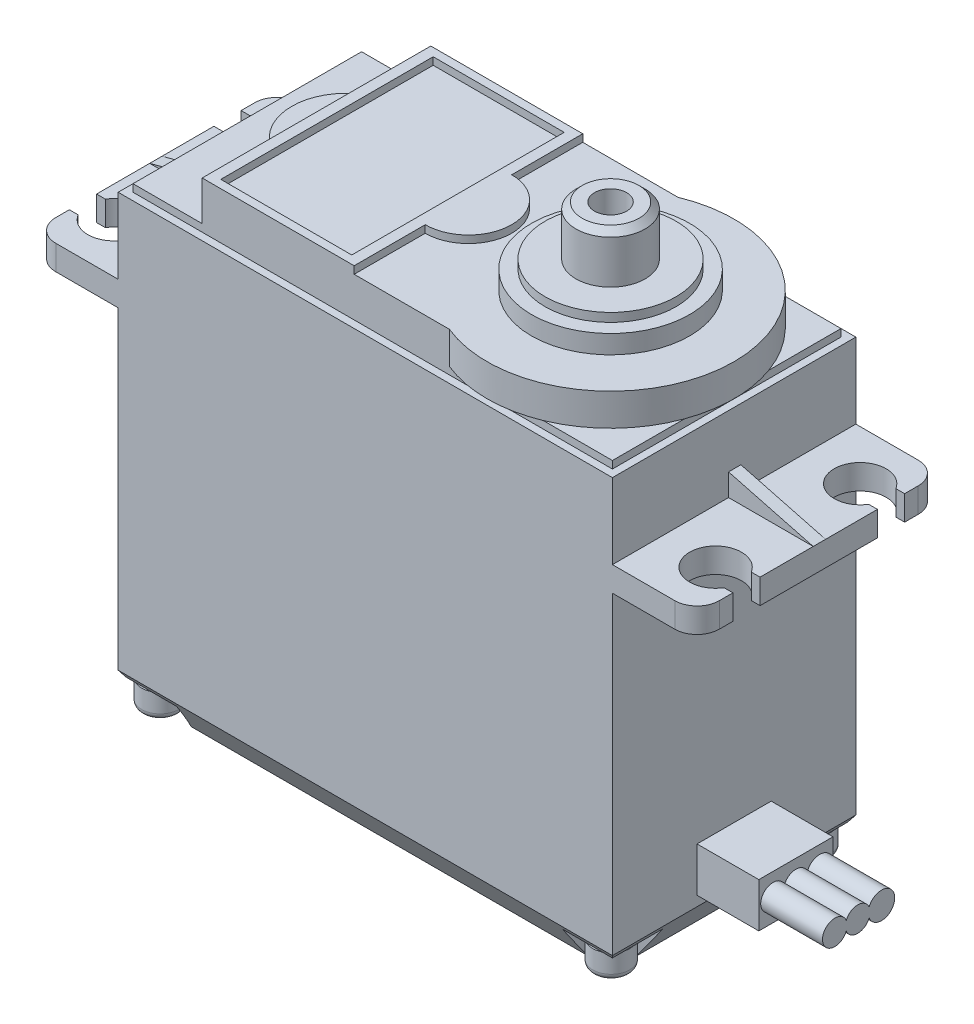
from build123d import *

# Parameters (mm, degrees)
SKETCH1_W            = 40
SKETCH1_H            = 36.5
BOSS_EXTRUDE1_DEPTH  = 19.7
CHAMFER1_SIZE        = 2
CHAMFER1_SIZE2       = 3
CUT_EXTRUDE1_DEPTH   = 2.5
SKETCH4_R            = 1.5
BOSS_EXTRUDE2_DEPTH  = 2
FILLET1_R            = 0.5
FILLET3_R            = 0.5
FILLET4_R            = 0.5
FILLET5_R            = 0.5
SKETCH5_W            = 53.7
SKETCH5_H            = 19.7
BOSS_EXTRUDE3_DEPTH  = 2
CUT_EXTRUDE2_DEPTH   = 2
FILLET9_R            = 1.8
BOSS_EXTRUDE4_DEPTH  = 1
SKETCH8_W            = 38.8
SKETCH8_H            = 18.5
BOSS_EXTRUDE5_DEPTH  = 0.6
BOSS_EXTRUDE6_DEPTH  = 2.6
SKETCH10_W           = 10.6
SKETCH10_H           = 17.190691902
BOSS_EXTRUDE7_DEPTH  = 0.6
SKETCH11_R           = 6.4
BOSS_EXTRUDE8_DEPTH  = 1.5
SKETCH12_R           = 5.3
BOSS_EXTRUDE9_DEPTH  = 0.7
SKETCH13_R           = 2.8
SKETCH13_R_2         = 1.3
BOSS_EXTRUDE10_DEPTH = 4
CHAMFER2_SIZE        = 0.5
CUT_EXTRUDE3_DEPTH   = 1.2
LPATTERN1_COUNT      = 2
LPATTERN1_PITCH      = 36.5
LPATTERN1_COUNT_DIR2 = 2
LPATTERN1_PITCH_DIR2 = 16.3
SKETCH16_W           = 6
SKETCH16_H           = 3.6
BOSS_EXTRUDE11_DEPTH = 5
BOSS_EXTRUDE16_DEPTH = 5
BOSS_EXTRUDE42_DEPTH = 5


with BuildPart() as part:
    # Sketch1 → Boss-Extrude1 (new body)
    with BuildSketch(Plane.XY):
        Rectangle(SKETCH1_W, SKETCH1_H)
    extrude(amount=BOSS_EXTRUDE1_DEPTH)

    # Chamfer1
    chamfer1_edges = [part.edges().sort_by_distance(p)[0] for p in [
        (0, -18.25, 19.7),
        (0, -18.25, 0),
        (20, -18.25, 9.85),
        (-20, -18.25, 9.85),
    ]]
    chamfer1_side = [part.faces().sort_by_distance(p)[0] for p in [
        (0, -18.25, 9.85),
    ]]
    chamfer(chamfer1_edges, length=CHAMFER1_SIZE, length2=CHAMFER1_SIZE2, reference=chamfer1_side[0])

    # Sketch2 → Cut-Extrude1 (cut)
    with BuildSketch(Plane.XZ.offset(18.25)):
        with BuildLine():
            Line((20, 15.3), (20, 19.7))
            Line((20, 19.7), (15.6, 19.7))
            ThreePointArc((15.6, 19.7), (16.888730163, 16.588730163), (20, 15.3))
        make_face()
        with BuildLine():
            Line((20, 4.4), (20, 0))
            Line((20, 0), (15.6, 0))
            ThreePointArc((15.6, 0), (16.888730163, 3.111269837), (20, 4.4))
        make_face()
        with BuildLine():
            Line((-15.6, 0), (-20, 0))
            Line((-20, 0), (-20, 4.4))
            ThreePointArc((-20, 4.4), (-16.888730163, 3.111269837), (-15.6, 0))
        make_face()
        with BuildLine():
            Line((-20, 15.3), (-20, 19.7))
            Line((-20, 19.7), (-15.6, 19.7))
            ThreePointArc((-15.6, 19.7), (-16.888730163, 16.588730163), (-20, 15.3))
        make_face()
    extrude(amount=-CUT_EXTRUDE1_DEPTH, mode=Mode.SUBTRACT)

    # Sketch4 → Boss-Extrude2 (add)
    with BuildSketch(Plane.XZ.offset(15.75)):
        with Locations(Location((18.20504142, 18.001219169, 0), (0, 0, 114.453388665))):
            Circle(SKETCH4_R)
        with Locations(Location((18.20504142, 1.751219169, 0), (0, 0, 250.954058998))):
            Circle(SKETCH4_R)
        with Locations(Location((-18.29495858, 1.751219169, 0), (0, 0, 203.869136849))):
            Circle(SKETCH4_R)
        with Locations(Location((-18.29495858, 18.001219169, 0), (0, 0, 156.130863151))):
            Circle(SKETCH4_R)
    extrude(amount=BOSS_EXTRUDE2_DEPTH)

    # Fillet1
    fillet1_edges = [part.edges().sort_by_distance(p)[0] for p in [
        (-16.923250494, -17.75, 17.39424559),
    ]]
    fillet(fillet1_edges, radius=FILLET1_R)

    # Fillet3
    fillet3_edges = [part.edges().sort_by_distance(p)[0] for p in [
        (-16.923250494, -17.75, 2.358192748),
    ]]
    fillet(fillet3_edges, radius=FILLET3_R)

    # Fillet4
    fillet4_edges = [part.edges().sort_by_distance(p)[0] for p in [
        (18.6945307, -17.75, 3.169105006),
    ]]
    fillet(fillet4_edges, radius=FILLET4_R)

    # Fillet5
    fillet5_edges = [part.edges().sort_by_distance(p)[0] for p in [
        (18.825970669, -17.75, 16.635771672),
    ]]
    fillet(fillet5_edges, radius=FILLET5_R)

    # Sketch5 → Boss-Extrude3 (add)
    with BuildSketch(Plane(origin=(0, 10.15, 0), x_dir=(-1, 0, 0), z_dir=(0, -1, 0))):
        with Locations((0, -9.85)):
            Rectangle(SKETCH5_W, SKETCH5_H)
    extrude(amount=-BOSS_EXTRUDE3_DEPTH)

    # Sketch6 → Cut-Extrude2 (cut)
    with BuildSketch(Plane.XZ.offset(-10.15)):
        with BuildLine():
            Line((26.85, 14.6), (26.138854382, 14.6))
            ThreePointArc((26.138854382, 14.6), (22.25, 15.7), (26.138854382, 16.8))
            Line((26.138854382, 16.8), (26.85, 16.8))
            Line((26.85, 16.8), (26.85, 14.6))
        make_face()
        with BuildLine():
            Line((26.85, 2.9), (26.138854382, 2.9))
            ThreePointArc((26.138854382, 2.9), (22.25, 4), (26.138854382, 5.1))
            Line((26.138854382, 5.1), (26.85, 5.1))
            Line((26.85, 5.1), (26.85, 2.9))
        make_face()
        with BuildLine():
            Line((-26.85, 5.1), (-26.138854382, 5.1))
            ThreePointArc((-26.138854382, 5.1), (-22.25, 4), (-26.138854382, 2.9))
            Line((-26.138854382, 2.9), (-26.85, 2.9))
            Line((-26.85, 2.9), (-26.85, 5.1))
        make_face()
        with BuildLine():
            Line((-26.85, 16.8), (-26.138854382, 16.8))
            ThreePointArc((-26.138854382, 16.8), (-22.25, 15.7), (-26.138854382, 14.6))
            Line((-26.138854382, 14.6), (-26.85, 14.6))
            Line((-26.85, 14.6), (-26.85, 16.8))
        make_face()
    extrude(amount=-CUT_EXTRUDE2_DEPTH, mode=Mode.SUBTRACT)

    # Fillet9
    fillet9_edges = [part.edges().sort_by_distance(p)[0] for p in [
        (26.85, 11.15, 0),
        (-26.85, 11.15, 0),
        (-26.85, 11.15, 19.7),
        (26.85, 11.15, 19.7),
    ]]
    fillet(fillet9_edges, radius=FILLET9_R)

    # Sketch7 → Boss-Extrude4 (add)
    with BuildSketch(Plane.XY.offset(10.3)):
        Polygon((-26.85, 12.15), (-20, 13.95), (-20, 12.15), align=None)
        Polygon((20, 12.15), (20, 13.95), (26.85, 12.15), align=None)
    extrude(amount=-BOSS_EXTRUDE4_DEPTH)

    # Sketch8 → Boss-Extrude5 (add)
    with BuildSketch(Plane(origin=(0, 18.25, 0), x_dir=(1, 0, 0), z_dir=(0, 1, 0))):
        with Locations((0, -9.85)):
            Rectangle(SKETCH8_W, SKETCH8_H)
    extrude(amount=BOSS_EXTRUDE5_DEPTH)

    # Sketch9 → Boss-Extrude6 (add)
    with BuildSketch(Plane(origin=(0, 18.85, 0), x_dir=(1, 0, 0), z_dir=(0, 1, 0))):
        with BuildLine():
            Line((-13.799671038, -6.162182217), (-13.799671038, -0.6))
            Line((-13.799671038, -0.6), (6.200328962, -0.6))
            ThreePointArc((6.200328962, -0.6), (20, -9.85), (6.200328962, -19.1))
            Line((6.200328962, -19.1), (-13.799671038, -19.1))
            Line((-13.799671038, -19.1), (-13.799671038, -13.537817783))
            ThreePointArc((-13.799671038, -13.537817783), (-15.799671038, -9.85), (-13.799671038, -6.162182217))
        make_face()
    extrude(amount=BOSS_EXTRUDE6_DEPTH)

    # Sketch10 → Boss-Extrude7 (add)
    with BuildSketch(Plane(origin=(0, 21.45, 0), x_dir=(1, 0, 0), z_dir=(0, 1, 0))):
        with BuildLine():
            Line((-13.799671038, -19.1), (-13.799671038, -0.6))
            Line((-13.799671038, -0.6), (-1.499671038, -0.6))
            Line((-1.499671038, -0.6), (-1.499671038, -6.35))
            ThreePointArc((-1.499671038, -6.35), (2.000328962, -9.85), (-1.499671038, -13.35))
            Line((-1.499671038, -13.35), (-1.499671038, -19.1))
            Line((-1.499671038, -19.1), (-13.799671038, -19.1))
        make_face()
        with Locations((-7.649671038, -9.85)):
            Rectangle(SKETCH10_W, SKETCH10_H, mode=Mode.SUBTRACT)
    extrude(amount=BOSS_EXTRUDE7_DEPTH)

    # Sketch11 → Boss-Extrude8 (add)
    with BuildSketch(Plane(origin=(0, 21.45, 0), x_dir=(1, 0, 0), z_dir=(0, 1, 0))):
        with Locations(Location((10, -9.85, 0), (0, 0, 270))):
            Circle(SKETCH11_R)
    extrude(amount=BOSS_EXTRUDE8_DEPTH)

    # Sketch12 → Boss-Extrude9 (add)
    with BuildSketch(Plane(origin=(0, 22.95, 0), x_dir=(1, 0, 0), z_dir=(0, 1, 0))):
        with Locations(Location((10, -9.85, 0), (0, 0, 270))):
            Circle(SKETCH12_R)
    extrude(amount=BOSS_EXTRUDE9_DEPTH)

    # Sketch13 → Boss-Extrude10 (add)
    with BuildSketch(Plane(origin=(0, 23.65, 0), x_dir=(1, 0, 0), z_dir=(0, 1, 0))):
        with Locations(Location((10, -9.85, 0), (0, 0, 270))):
            Circle(SKETCH13_R)
        with Locations(Location((10, -9.85, 0), (0, 0, 270))):
            Circle(SKETCH13_R_2, mode=Mode.SUBTRACT)
    extrude(amount=BOSS_EXTRUDE10_DEPTH)

    # Chamfer2
    chamfer2_edges = [part.edges().sort_by_distance(p)[0] for p in [
        (10, 27.65, 7.05),
    ]]
    chamfer(chamfer2_edges, length=CHAMFER2_SIZE)

    # Sketch15 → Cut-Extrude3 (cut)
    with BuildSketch(Plane.XZ.offset(17.75)):
        Polygon((18.05504142, 1.601219169), (18.05504142, 0.901219169), (18.35504142, 0.901219169), (18.35504142, 1.601219169), (19.05504142, 1.601219169), (19.05504142, 1.901219169), (18.35504142, 1.901219169), (18.35504142, 2.601219169), (18.05504142, 2.601219169), (18.05504142, 1.901219169), (17.35504142, 1.901219169), (17.35504142, 1.601219169), align=None)
    cut_extrude3 = extrude(amount=-CUT_EXTRUDE3_DEPTH, mode=Mode.SUBTRACT)

    # LPattern1: Cut-Extrude3 2 × 2
    with Locations(*[(-i * LPATTERN1_PITCH, 0, j * LPATTERN1_PITCH_DIR2) for i in range(LPATTERN1_COUNT) for j in range(LPATTERN1_COUNT_DIR2) if (i, j) != (0, 0)]):
        add(cut_extrude3, mode=Mode.SUBTRACT)

    # Sketch16 → Boss-Extrude11 (add)
    with BuildSketch(Plane(origin=(20, 0, 0), x_dir=(0, 0, -1), z_dir=(1, 0, 0))):
        with Locations((-9.85, -12.65)):
            Rectangle(SKETCH16_W, SKETCH16_H)
    extrude(amount=BOSS_EXTRUDE11_DEPTH)

    # Sketch17 → Boss-Extrude16 (add)
    with BuildSketch(Plane(origin=(25, 0, 0), x_dir=(0, 0, -1), z_dir=(1, 0, 0))):
        with BuildLine():
            ThreePointArc((-10.775, -13.00161488), (-9.85, -13.621647776), (-8.925, -13.00161488))
            ThreePointArc((-8.925, -13.00161488), (-6.85, -12.621647776), (-8.925, -12.241680672))
            ThreePointArc((-8.925, -12.241680672), (-9.85, -11.621647776), (-10.775, -12.241680672))
            ThreePointArc((-10.775, -12.241680672), (-12.7, -12.621647776), (-10.775, -13.00161488))
        make_face()
    extrude(amount=BOSS_EXTRUDE16_DEPTH)

    # Sketch17<9> → Boss-Extrude42 (add)
    with BuildSketch(Plane(origin=(25, 0, 0), x_dir=(0, 0, -1), z_dir=(1, 0, 0))):
        with BuildLine():
            ThreePointArc((-10.775, -13.00161488), (-9.85, -13.621647776), (-8.925, -13.00161488))
            ThreePointArc((-8.925, -13.00161488), (-6.85, -12.621647776), (-8.925, -12.241680672))
            ThreePointArc((-8.925, -12.241680672), (-9.85, -11.621647776), (-10.775, -12.241680672))
            ThreePointArc((-10.775, -12.241680672), (-12.7, -12.621647776), (-10.775, -13.00161488))
        make_face()
    extrude(amount=BOSS_EXTRUDE42_DEPTH)


solid = part.part
